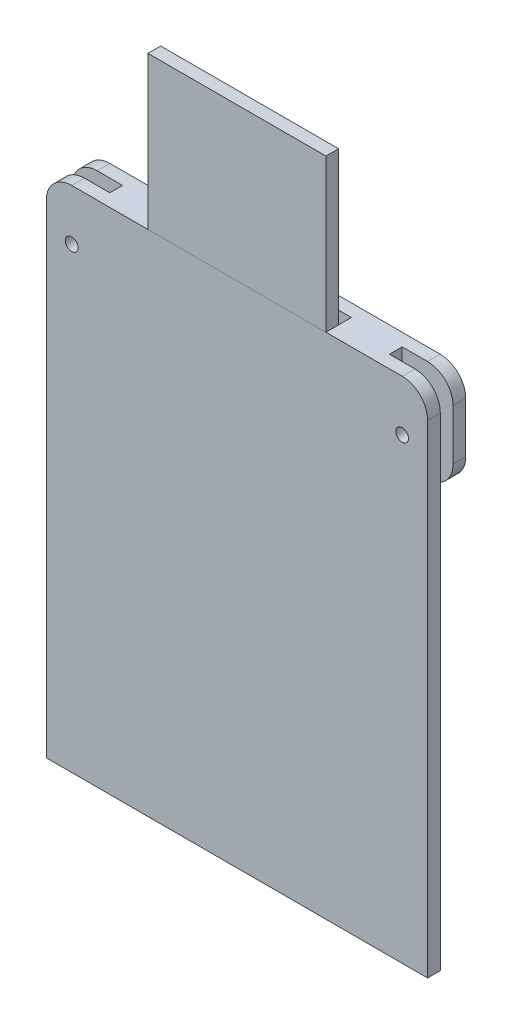
from build123d import *

# Parameters (mm, degrees)
SKETCH2_W               = 150
SKETCH2_H               = 200
BOSS_EXTRUDE1_DEPTH     = 5
SKETCH4_W               = 20
SKETCH4_H               = 40
BOSS_EXTRUDE2_DEPTH     = 5
SKETCH6_W               = 150
SKETCH6_H               = 40
BOSS_EXTRUDE3_DEPTH     = 5
CUT_EXTRUDE1_DEPTH      = 180.514612304
CUT_EXTRUDE1_DEPTH_BACK = 180.514612304
SKETCH7_R               = 2.5
FILLET1_R               = 10
FILLET2_R               = 10
FILLET3_R               = 10
FILLET4_R               = 10
FILLET5_R               = 10
FILLET6_R               = 10
SKETCH9_W               = 12
SKETCH9_H               = 22
BOSS_EXTRUDE4_DEPTH     = 23
SKETCH10_R              = 6
BOSS_EXTRUDE5_DEPTH     = 4
SKETCH11_R              = 2
BOSS_EXTRUDE6_DEPTH     = 3
SKETCH12_W              = 5
SKETCH12_H              = 50
BOSS_EXTRUDE7_DEPTH     = 15
SKETCH13_W              = 12
SKETCH13_H              = 5
BOSS_EXTRUDE10_DEPTH    = 15
BOSS_EXTRUDE10_2_DEPTH  = 15
SKETCH15_W              = 70
SKETCH15_H              = 15
BOSS_EXTRUDE11_DEPTH    = 60
SKETCH16_W              = 70
SKETCH16_H              = 10
CUT_EXTRUDE2_DEPTH      = 60


with BuildPart() as part:
    # Sketch2 → Boss-Extrude1 (new body)
    with BuildSketch(Plane.XY):
        with Locations((4.784343526, -60.49907962)):
            Rectangle(SKETCH2_W, SKETCH2_H)
    extrude(amount=BOSS_EXTRUDE1_DEPTH)

    # Sketch4 → Boss-Extrude2 (add)
    with BuildSketch(Plane(origin=(0, 0, 0), x_dir=(-1, 0, 0), z_dir=(0, 0, -1))):
        with Locations((-49.784343526, 19.50092038)):
            Rectangle(SKETCH4_W, SKETCH4_H)
        with Locations((40.215656474, 19.50092038)):
            Rectangle(SKETCH4_W, SKETCH4_H)
    extrude(amount=BOSS_EXTRUDE2_DEPTH)

    # Sketch6 → Boss-Extrude3 (add)
    with BuildSketch(Plane(origin=(0, 0, -5), x_dir=(-1, 0, 0), z_dir=(0, 0, -1))):
        with Locations((-4.784343526, 19.50092038)):
            Rectangle(SKETCH6_W, SKETCH6_H)
    extrude(amount=BOSS_EXTRUDE3_DEPTH)

    # Sketch7 → Cut-Extrude1 (cut, two sides: drawn at the far end of the back side and taken through both)
    with BuildSketch(Plane(origin=(0, 0, 0), x_dir=(-1, 0, 0), z_dir=(0, 0, -1)).offset(-CUT_EXTRUDE1_DEPTH_BACK)):
        with Locations((-69.784343526, 19.50092038)):
            Circle(SKETCH7_R)
        with Locations((60.215656474, 19.50092038)):
            Circle(SKETCH7_R)
    extrude(amount=CUT_EXTRUDE1_DEPTH + CUT_EXTRUDE1_DEPTH_BACK, mode=Mode.SUBTRACT)

    # Fillet1
    fillet1_edges = [part.edges().sort_by_distance(p)[0] for p in [
        (-70.215656474, 39.50092038, -7.5),
    ]]
    fillet(fillet1_edges, radius=FILLET1_R)

    # Fillet2
    fillet2_edges = [part.edges().sort_by_distance(p)[0] for p in [
        (-70.215656474, 39.50092038, 2.5),
    ]]
    fillet(fillet2_edges, radius=FILLET2_R)

    # Fillet3
    fillet3_edges = [part.edges().sort_by_distance(p)[0] for p in [
        (79.784343526, 39.50092038, 2.5),
    ]]
    fillet(fillet3_edges, radius=FILLET3_R)

    # Fillet4
    fillet4_edges = [part.edges().sort_by_distance(p)[0] for p in [
        (79.784343526, 39.50092038, -7.5),
    ]]
    fillet(fillet4_edges, radius=FILLET4_R)

    # Fillet5
    fillet5_edges = [part.edges().sort_by_distance(p)[0] for p in [
        (79.784343526, -0.49907962, -7.5),
    ]]
    fillet(fillet5_edges, radius=FILLET5_R)

    # Fillet6
    fillet6_edges = [part.edges().sort_by_distance(p)[0] for p in [
        (-70.215656474, -0.49907962, -7.5),
    ]]
    fillet(fillet6_edges, radius=FILLET6_R)

    # Sketch9 → Boss-Extrude4 (add)
    with BuildSketch(Plane(origin=(0, 0, 0), x_dir=(-1, 0, 0), z_dir=(0, 0, -1))):
        with Locations((-4.784343526, -44.49907962)):
            Rectangle(SKETCH9_W, SKETCH9_H)
    extrude(amount=BOSS_EXTRUDE4_DEPTH)

    # Sketch10 → Boss-Extrude5 (add)
    with BuildSketch(Plane(origin=(0, 0, -23), x_dir=(-1, 0, 0), z_dir=(0, 0, -1))):
        with Locations((-4.784343526, -40.49907962)):
            Circle(SKETCH10_R)
    extrude(amount=BOSS_EXTRUDE5_DEPTH)

    # Sketch11 → Boss-Extrude6 (add)
    with BuildSketch(Plane(origin=(0, 0, -27), x_dir=(-1, 0, 0), z_dir=(0, 0, -1))):
        with Locations((-4.784343526, -40.49907962)):
            Circle(SKETCH11_R)
    extrude(amount=BOSS_EXTRUDE6_DEPTH)

    # Sketch12 → Boss-Extrude7 (add)
    with BuildSketch(Plane(origin=(0, 0, 0), x_dir=(-1, 0, 0), z_dir=(0, 0, -1))):
        with Locations((-13.284343526, -43.49907962)):
            Rectangle(SKETCH12_W, SKETCH12_H)
        with Locations((3.715656474, -43.49907962)):
            Rectangle(SKETCH12_W, SKETCH12_H)
    extrude(amount=BOSS_EXTRUDE7_DEPTH)


with BuildPart() as body_2:
    # Sketch13 → Boss-Extrude10 (new body)
    with BuildSketch(Plane(origin=(0, 0, -15), x_dir=(-1, 0, 0), z_dir=(0, 0, -1))):
        with Locations((-4.784343526, -30.99907962)):
            Rectangle(SKETCH13_W, SKETCH13_H)
    extrude(amount=-BOSS_EXTRUDE10_DEPTH)


with BuildPart() as body_3:
    # Sketch13 → Boss-Extrude10 2 (new body)
    with BuildSketch(Plane(origin=(0, 0, -15), x_dir=(-1, 0, 0), z_dir=(0, 0, -1))):
        with Locations((-4.784343526, -57.99907962)):
            Rectangle(SKETCH13_W, SKETCH13_H)
    extrude(amount=-BOSS_EXTRUDE10_2_DEPTH)


with BuildPart() as body_4:
    # Sketch15 → Boss-Extrude11 (new body)
    with BuildSketch(Plane(origin=(0, 39.50092038, 0), x_dir=(1, 0, 0), z_dir=(0, 1, 0))):
        with Locations((4.784343526, 2.5)):
            Rectangle(SKETCH15_W, SKETCH15_H)
    extrude(amount=BOSS_EXTRUDE11_DEPTH)

    # Sketch16 → Cut-Extrude2 (cut)
    with BuildSketch(Plane(origin=(0, 99.50092038, 0), x_dir=(1, 0, 0), z_dir=(0, 1, 0))):
        with Locations((4.784343526, 5)):
            Rectangle(SKETCH16_W, SKETCH16_H)
    extrude(amount=-CUT_EXTRUDE2_DEPTH, mode=Mode.SUBTRACT)


solid = Compound([part.part, body_2.part, body_3.part, body_4.part])
